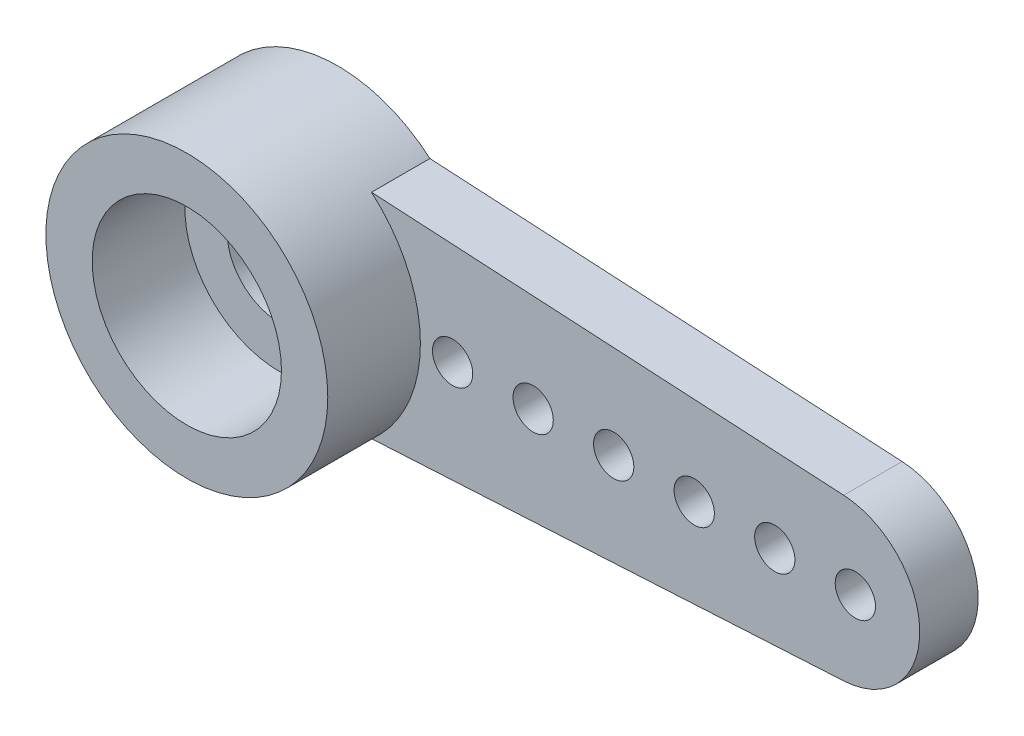
from build123d import *

# Parameters (mm, degrees)
SKETCH_1_R             = 2.773056395
SKETCH_1_R_2           = 2
SKETCH_1_R_3           = 3.5
EXTRUDE_1_DEPTH        = 1.45
SKETCH_2_R             = 3.5
SKETCH_2_R_2           = 2.35
EXTRUDE_2_DEPTH        = 2.3
SKETCH_3_R             = 2.3
CUT_EXTRUDE_1_DEPTH    = 0.7
SKETCH_4_R             = 1.3
CUT_EXTRUDE_2_DEPTH    = 17.563891451
SKETCH_5_R             = 0.5
CUT_EXTRUDE_3_DEPTH    = 17.706959628
PATTERN_LINEAR_1_COUNT = 6
PATTERN_LINEAR_1_PITCH = 2


with BuildPart() as part:
    # 草图1 → 凸台-拉伸1 (new body)
    with BuildSketch(Plane.XY):
        with BuildLine():
            Line((0.154225095, 2.768764415), (-1.97792246, 2.887528829))
            ThreePointArc((-1.97792246, 2.887528829), (-3.5, 0), (-1.97792246, -2.887528829))
            Line((-1.97792246, -2.887528829), (0.154225041, -2.768764418))
            ThreePointArc((0.154225041, -2.768764418), (-2.773056395, 2.7e-08), (0.154225095, 2.768764415))
        make_face()
        with BuildLine():
            Line((2.286372673, 2.65), (0.154225095, 2.768764415))
            ThreePointArc((0.154225095, 2.768764415), (2.014636028, 1.905540197), (2.773056395, 0))
            ThreePointArc((2.773056395, 0), (2.01463601, -1.905540216), (0.154225041, -2.768764418))
            Line((0.154225041, -2.768764418), (2.286372673, -2.65))
            ThreePointArc((2.286372673, -2.65), (3.182161557, -1.457342726), (3.5, 0))
            ThreePointArc((3.5, 0), (3.182161557, 1.457342726), (2.286372673, 2.65))
        make_face()
        Circle(SKETCH_1_R)
        with BuildLine():
            ThreePointArc((2.286372673, 2.65), (0.194654488, 3.494582898), (-1.97792246, 2.887528829))
            Line((-1.97792246, 2.887528829), (0.154225095, 2.768764415))
            Line((0.154225095, 2.768764415), (2.286372673, 2.65))
        make_face()
        with BuildLine():
            Line((0.154225041, -2.768764418), (-1.97792246, -2.887528829))
            ThreePointArc((-1.97792246, -2.887528829), (0.194654488, -3.494582898), (2.286372673, -2.65))
            Line((2.286372673, -2.65), (0.154225041, -2.768764418))
        make_face()
        with BuildLine():
            Line((14.011231163, 1.996904512), (2.286372673, 2.65))
            ThreePointArc((2.286372673, 2.65), (3.182161557, 1.457342726), (3.5, 0))
            ThreePointArc((3.5, 0), (3.182161557, -1.457342726), (2.286372673, -2.65))
            Line((2.286372673, -2.65), (14.011231138, -1.996904513))
            ThreePointArc((14.011231138, -1.996904513), (11.9, 1.2e-08), (14.011231163, 1.996904512))
        make_face()
        with Locations((13.9, 0)):
            Circle(SKETCH_1_R_2)
        Circle(SKETCH_1_R_3)
    extrude(amount=EXTRUDE_1_DEPTH)

    # 草图2 → 凸台-拉伸2 (add)
    with BuildSketch(Plane.XY.offset(1.45)):
        with Locations(Location((0, 0, 0), (0, 0, 310.787038193))):
            Circle(SKETCH_2_R)
        Circle(SKETCH_2_R_2, mode=Mode.SUBTRACT)
    extrude(amount=EXTRUDE_2_DEPTH)

    # 草图3 → 切除-拉伸1 (cut)
    with BuildSketch(Plane(origin=(0, 0, 0), x_dir=(-1, 0, 0), z_dir=(0, 0, -1))):
        Circle(SKETCH_3_R)
    extrude(amount=-CUT_EXTRUDE_1_DEPTH, mode=Mode.SUBTRACT)

    # 草图4 → 切除-拉伸2 (cut, through all)
    with BuildSketch(Plane(origin=(0, 0, 0.7), x_dir=(-1, 0, 0), z_dir=(0, 0, -1))):
        Circle(SKETCH_4_R)
    extrude(amount=-CUT_EXTRUDE_2_DEPTH, mode=Mode.SUBTRACT)

    # 草图5 → 切除-拉伸3 (cut, through all)
    with BuildSketch(Plane(origin=(0, 0, 0), x_dir=(-1, 0, 0), z_dir=(0, 0, -1))):
        with Locations((-14.3, 0)):
            Circle(SKETCH_5_R)
    cut_extrude_3 = extrude(amount=-CUT_EXTRUDE_3_DEPTH, mode=Mode.SUBTRACT)

    # 阵列(线性)1: 切除-拉伸3 ×6
    with Locations(*[(-i * PATTERN_LINEAR_1_PITCH, 0, 0) for i in range(1, PATTERN_LINEAR_1_COUNT)]):
        add(cut_extrude_3, mode=Mode.SUBTRACT)


solid = part.part
